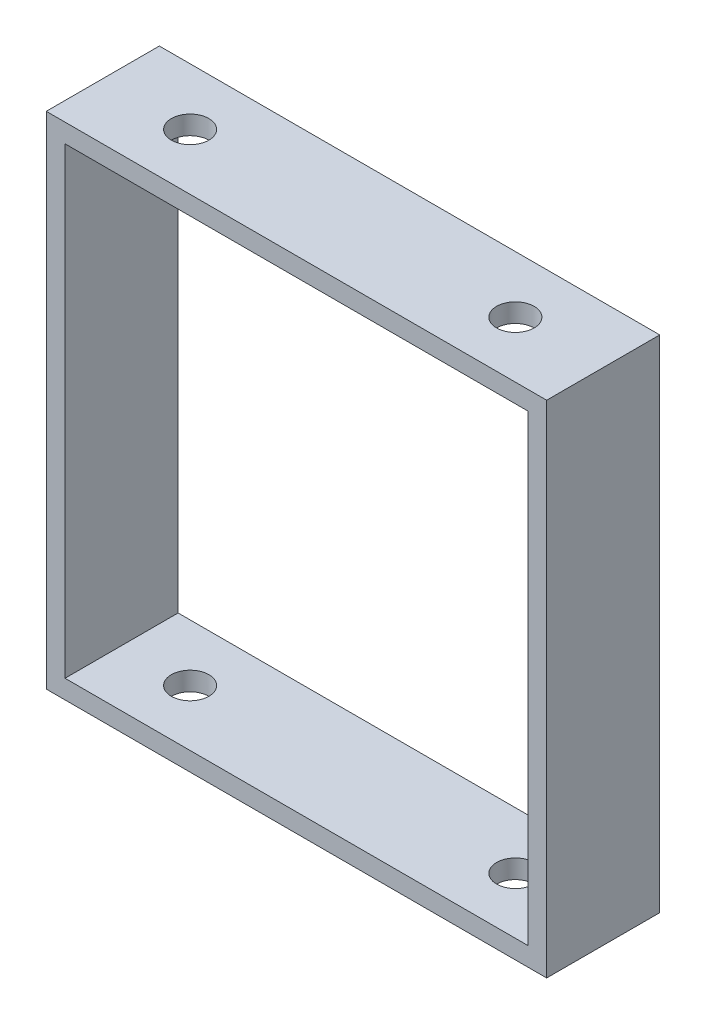
from build123d import *

# Parameters (mm, degrees)
SKETCH2_W           = 127
SKETCH2_H           = 127
BOSS_EXTRUDE1_DEPTH = 28.702
SKETCH3_W           = 117.475
SKETCH3_H           = 117.475
CUT_EXTRUDE1_DEPTH  = 28.702
CUT_EXTRUDE2_REACH  = 146.862
SKETCH4_R           = 4.7625


with BuildPart() as part:
    # Sketch2 → Boss-Extrude1 (new body)
    with BuildSketch(Plane.XY):
        Rectangle(SKETCH2_W, SKETCH2_H)
    extrude(amount=BOSS_EXTRUDE1_DEPTH)

    # Sketch3 → Cut-Extrude1 (cut)
    with BuildSketch(Plane.XY.offset(28.702)):
        Rectangle(SKETCH3_W, SKETCH3_H)
    extrude(amount=-CUT_EXTRUDE1_DEPTH, mode=Mode.SUBTRACT)

    # Cut-Extrude2: up to this face of the body (flat: up to its plane)
    cut_extrude2_end = Plane(part.part.faces().sort_by_distance((0, -63.5, 14.351))[0])
    # Sketch4 → Cut-Extrude2 (cut, up to the picked face)
    with BuildSketch(Plane(origin=(0, 63.5, 0), x_dir=(1, 0, 0), z_dir=(0, 1, 0)), mode=Mode.PRIVATE) as cut_extrude2_sk1:
        with Locations(Location((41.275, -14.4145, 0), (0, 0, 270))):
            Circle(SKETCH4_R)
    cut_extrude2_tool1 = split(extrude(cut_extrude2_sk1.sketch, amount=-CUT_EXTRUDE2_REACH, mode=Mode.PRIVATE), bisect_by=cut_extrude2_end, keep=Keep.BOTH, mode=Mode.PRIVATE)
    # Sketch4 → Cut-Extrude2 (cut, up to the picked face)
    with BuildSketch(Plane(origin=(0, 63.5, 0), x_dir=(1, 0, 0), z_dir=(0, 1, 0)), mode=Mode.PRIVATE) as cut_extrude2_sk2:
        with Locations(Location((-41.275, -14.4145, 0), (0, 0, 270))):
            Circle(SKETCH4_R)
    cut_extrude2_tool2 = split(extrude(cut_extrude2_sk2.sketch, amount=-CUT_EXTRUDE2_REACH, mode=Mode.PRIVATE), bisect_by=cut_extrude2_end, keep=Keep.BOTH, mode=Mode.PRIVATE)
    add(cut_extrude2_tool1.solids().sort_by(Axis((41.275, 63.5, 14.4145), (0, -1, 0)))[0], mode=Mode.SUBTRACT)
    add(cut_extrude2_tool2.solids().sort_by(Axis((-41.275, 63.5, 14.4145), (0, -1, 0)))[0], mode=Mode.SUBTRACT)


solid = part.part
